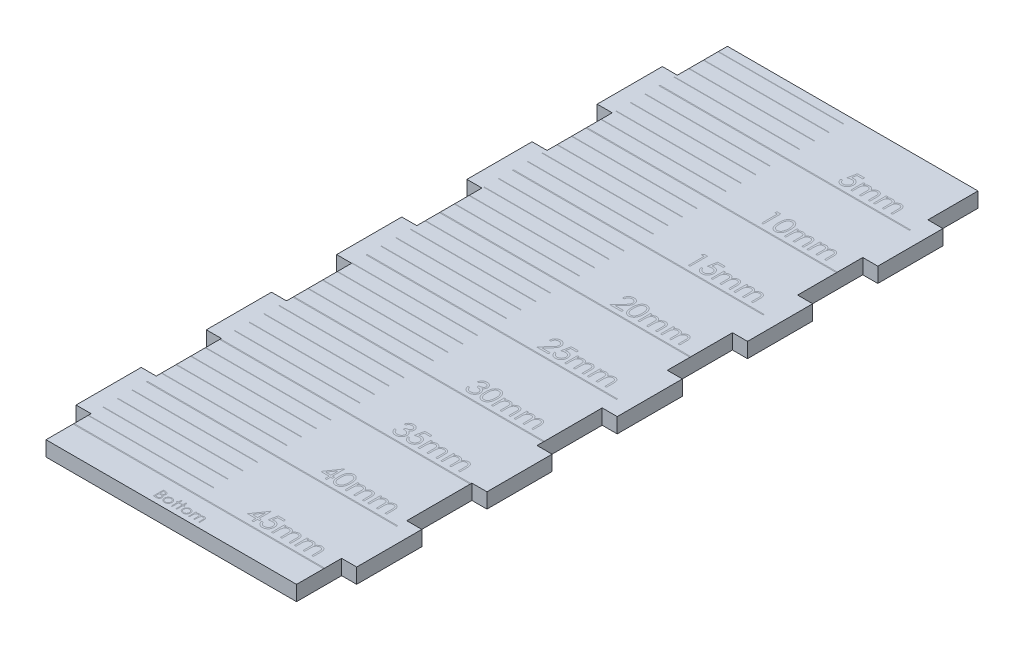
from build123d import *

# Parameters (mm, degrees)
BOSS_EXTRUDE1_DEPTH = 3


with BuildPart() as part:
    # Sketch1 → Boss-Extrude1 (new body)
    with BuildSketch(Plane(origin=(0, 0, 0), x_dir=(1, 0, 0), z_dir=(0, 1, 0))):
        Polygon((0, 136), (0, 126), (-3, 126), (-3, 113), (0, 113), (0, 100), (-3, 100), (-3, 87), (0, 87), (0, 74), (-3, 74), (-3, 61), (0, 61), (0, 48), (-3, 48), (-3, 35), (0, 35), (0, 22), (-3, 22), (-3, 9), (0, 9), (0, 0), (50, 0), (50, 9), (53, 9), (53, 22), (50, 22), (50, 35), (53, 35), (53, 48), (50, 48), (50, 61), (53, 61), (53, 74), (50, 74), (50, 87), (53, 87), (53, 100), (50, 100), (50, 113), (53, 113), (53, 126), (50, 126), (50, 136), align=None)
    extrude(amount=BOSS_EXTRUDE1_DEPTH)


solid = part.part
